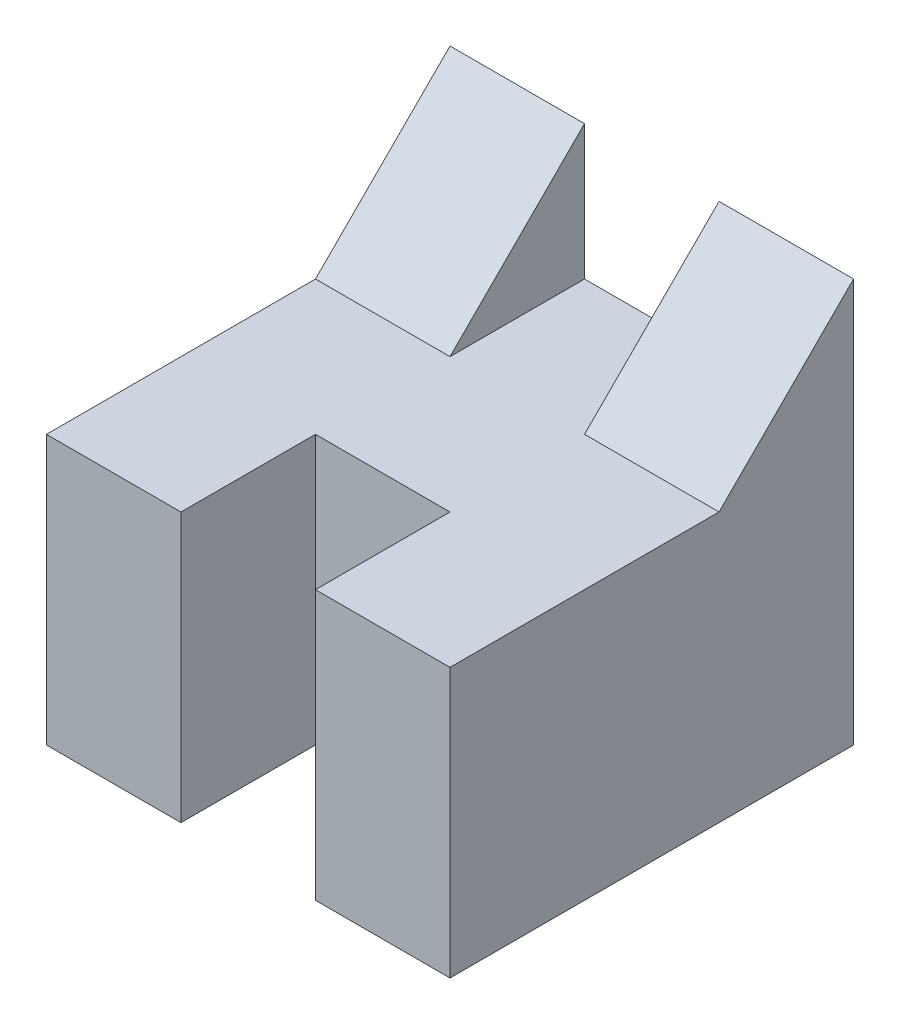
from build123d import *

# Parameters (mm, degrees)
SKETCH_1_W           = 30
SKETCH_1_H           = 30
EXTRUDE_1_DEPTH      = 30
SKETCH_42_W          = 10
SKETCH_42_H          = 10
CUT_EXTRUDE_29_DEPTH = 52.961524227
SKETCH_43_W          = 20
SKETCH_43_H          = 10
CUT_EXTRUDE_30_DEPTH = 52.961524227
SKETCH_44_W          = 10
SKETCH_44_H          = 10
CUT_EXTRUDE_31_DEPTH = 47.904157598


with BuildPart() as part:
    # 草圖1 → 填料-伸1 (new body)
    with BuildSketch(Plane.XY):
        with Locations((15, 15)):
            Rectangle(SKETCH_1_W, SKETCH_1_H)
    extrude(amount=-EXTRUDE_1_DEPTH)

    # 草圖42 → 除料-伸長29 (cut, through all)
    with BuildSketch(Plane.XY):
        with Locations((15, 25)):
            Rectangle(SKETCH_42_W, SKETCH_42_H)
    extrude(amount=-CUT_EXTRUDE_29_DEPTH, mode=Mode.SUBTRACT)

    # 草圖43 → 除料-伸長30 (cut, through all)
    with BuildSketch(Plane(origin=(30, 0, 0), x_dir=(0, 0, -1), z_dir=(1, 0, 0))):
        Polygon((30, 30), (20, 30), (20, 20), align=None)
        with Locations((10, 25)):
            Rectangle(SKETCH_43_W, SKETCH_43_H)
    extrude(amount=-CUT_EXTRUDE_30_DEPTH, mode=Mode.SUBTRACT)

    # 草圖44 → 除料-伸長31 (cut, through all)
    with BuildSketch(Plane(origin=(0, 20, 0), x_dir=(1, 0, 0), z_dir=(0, 1, 0))):
        with Locations((15, 5)):
            Rectangle(SKETCH_44_W, SKETCH_44_H)
    extrude(amount=-CUT_EXTRUDE_31_DEPTH, mode=Mode.SUBTRACT)


solid = part.part
